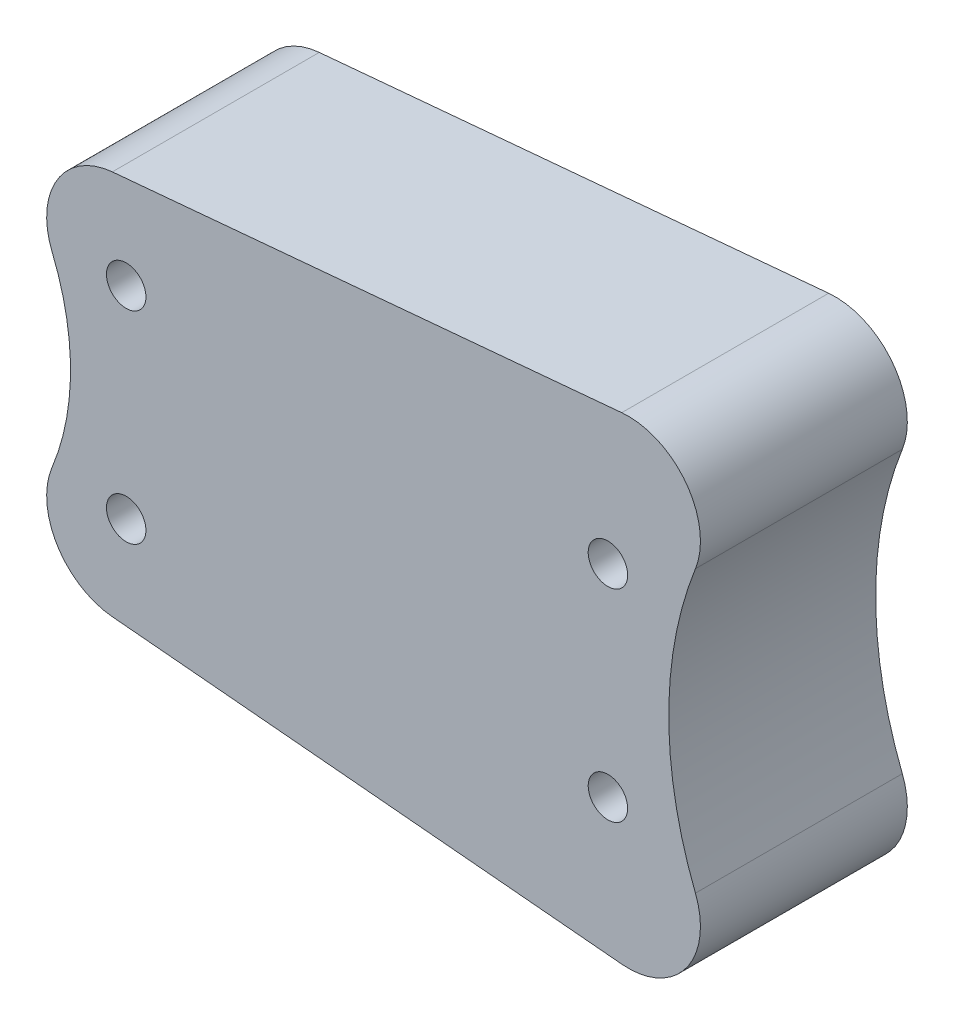
from build123d import *

# Parameters (mm, degrees)
SKETCH_1_R      = 4.1
EXTRUDE_1_DEPTH = 21.5
FILLET_1_R      = 15


with BuildPart() as part:
    # ｽｹｯﾁ1 → ﾎﾞｽ - 押し出し1 (new, symmetric)
    with BuildSketch(Plane.XY):
        with BuildLine():
            Line((-220.71165321, 37.734887356), (-60.125305402, 52.28709885))
            ThreePointArc((-60.125305402, 52.28709885), (-79.680568873, 0), (-60.125305402, -52.28709885))
            Line((-60.125305402, -52.28709885), (-220.71165321, -37.734887356))
            ThreePointArc((-220.71165321, -37.734887356), (-204.013605252, 0), (-220.71165321, 37.734887356))
        make_face()
        with Locations((-192.444390405, 21)):
            Circle(SKETCH_1_R, mode=Mode.SUBTRACT)
        with Locations((-192.444390405, -21)):
            Circle(SKETCH_1_R, mode=Mode.SUBTRACT)
        with Locations((-92.32231649, -21)):
            Circle(SKETCH_1_R, mode=Mode.SUBTRACT)
        with Locations((-92.32231649, 21)):
            Circle(SKETCH_1_R, mode=Mode.SUBTRACT)
    extrude(amount=EXTRUDE_1_DEPTH, both=True)

    # ﾌｨﾚｯﾄ1
    fillet_1_edges = [part.edges().sort_by_distance(p)[0] for p in [
        (-220.71165321, -37.734887356, 0),
        (-220.71165321, 37.734887356, 0),
        (-60.125305402, -52.28709885, 0),
        (-60.125305402, 52.28709885, 0),
    ]]
    fillet(fillet_1_edges, radius=FILLET_1_R)


solid = part.part
